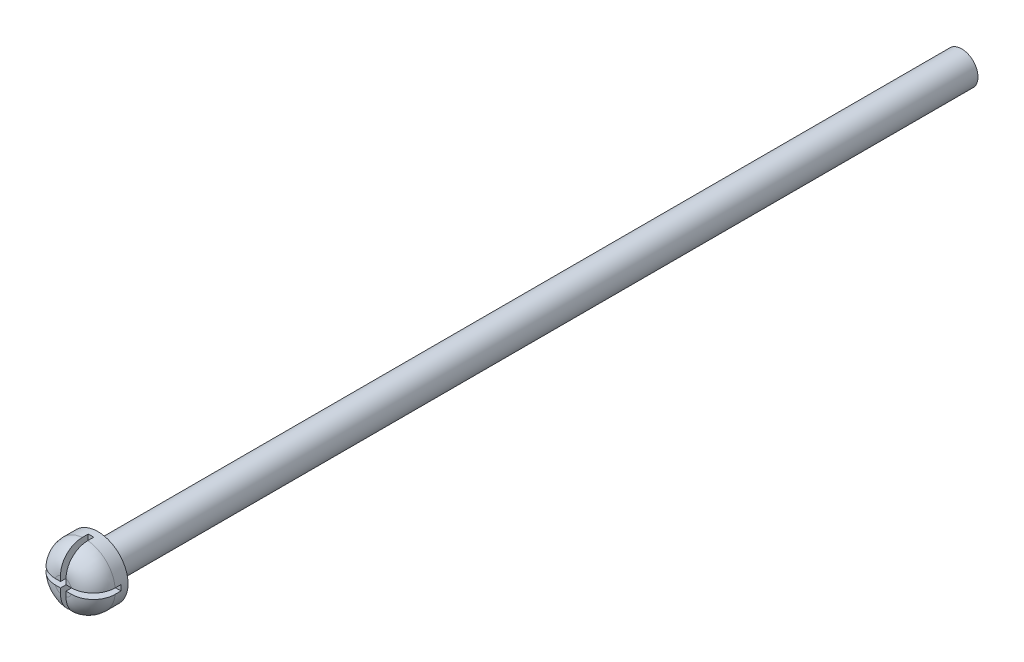
from build123d import *

# Parameters (mm, degrees)
SKETCH1_R               = 1.5
BOSS_EXTRUDE1_DEPTH     = 82.55
SKETCH3_R               = 2.775
BOSS_EXTRUDE3_DEPTH     = 3.175
SKETCH4_W               = 0.508
SKETCH4_H               = 6.00854879
SKETCH4_W_2             = 6.00854879
SKETCH4_H_2             = 0.508
CUT_EXTRUDE_THIN1_DEPTH = 2.54
FILLET2_R               = 2


with BuildPart() as part:
    # Sketch1 → Boss-Extrude1 (new body)
    with BuildSketch(Plane.XY):
        Circle(SKETCH1_R)
    extrude(amount=BOSS_EXTRUDE1_DEPTH)

    # Sketch3 → Boss-Extrude3 (add)
    with BuildSketch(Plane.XY.offset(82.55)):
        Circle(SKETCH3_R)
    extrude(amount=-BOSS_EXTRUDE3_DEPTH)

    # Sketch4 → Cut-Extrude-Thin1 (cut)
    with BuildSketch(Plane.XY.offset(82.55)):
        Rectangle(SKETCH4_W, SKETCH4_H)
        Rectangle(SKETCH4_W_2, SKETCH4_H_2)
    extrude(amount=-CUT_EXTRUDE_THIN1_DEPTH, mode=Mode.SUBTRACT)

    # Fillet2
    fillet2_edges = [part.edges().sort_by_distance(p)[0] for p in [
        (-1.962221318, 1.962221318, 82.55),
        (-1.962221318, -1.962221318, 82.55),
        (1.962221318, -1.962221318, 82.55),
        (1.962221318, 1.962221318, 82.55),
    ]]
    fillet(fillet2_edges, radius=FILLET2_R)


solid = part.part
